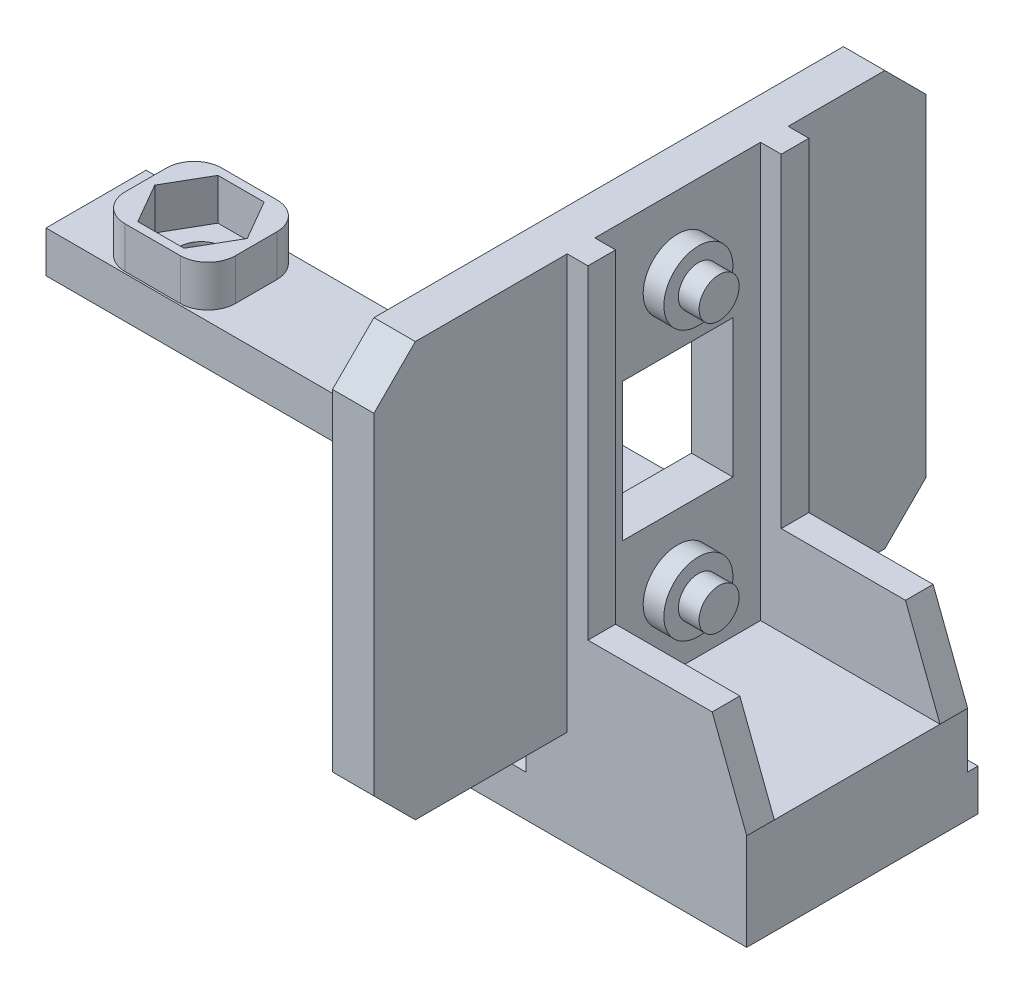
from build123d import *

# Parameters (mm, degrees)
SKETCH1_W               = 56
SKETCH1_H               = 7.25
SKETCH1_R               = 1.6
SKETCH1_W_2             = 5
SKETCH1_H_2             = 16.75
SKETCH1_W_3             = 11.5
BOSS_EXTRUDE1_DEPTH     = 3
SKETCH2_W               = 8
SKETCH2_H               = 7
BOSS_EXTRUDE2_DEPTH     = 3
FILLET1_R               = 2
SKETCH3_W               = 16
SKETCH3_H               = 16
BOSS_EXTRUDE3_DEPTH     = 4
BOSS_EXTRUDE4_DEPTH     = 3
BOSS_EXTRUDE5_DEPTH     = 2
BOSS_EXTRUDE6_DEPTH     = 2
CHAMFER1_SIZE           = 3
SKETCH8_W               = 8
SKETCH8_H               = 10
CUT_EXTRUDE1_DEPTH      = 10
SKETCH9_R               = 1.45
BOSS_EXTRUDE7_DEPTH     = 3
SKETCH11_R              = 2.5
BOSS_EXTRUDE8_DEPTH     = 1.5
CUT_EXTRUDE3_DEPTH      = 74.518705103
CUT_EXTRUDE3_DEPTH_BACK = 2
CUT_EXTRUDE4_DEPTH      = 72.979163652
CUT_EXTRUDE4_DEPTH_BACK = 2


with BuildPart() as part:
    # Sketch1 → Boss-Extrude1 (new body)
    # profile 1 of 4: a face of its own
    with BuildSketch(Plane(origin=(0, 0, 0), x_dir=(1, 0, 0), z_dir=(0, 1, 0))):
        with Locations((-28, 3.625)):
            Rectangle(SKETCH1_W, SKETCH1_H)
        with Locations(Location((-7.6, 3.625, 0), (0, 0, 270))):
            Circle(SKETCH1_R, mode=Mode.SUBTRACT)
        with Locations(Location((-48.4, 3.625, 0), (0, 0, 270))):
            Circle(SKETCH1_R, mode=Mode.SUBTRACT)
    # profile 2 of 4: a face of its own
    with BuildSketch(Plane(origin=(0, 0, 0), x_dir=(1, 0, 0), z_dir=(0, 1, 0))):
        with Locations((-2.5, -8.375)):
            Rectangle(SKETCH1_W_2, SKETCH1_H_2)
    # profile 3 of 4: a face of its own
    with BuildSketch(Plane(origin=(0, 0, 0), x_dir=(1, 0, 0), z_dir=(0, 1, 0))):
        with Locations((5.75, -8.375)):
            Rectangle(SKETCH1_W_3, SKETCH1_H_2)
    # profile 4 of 4: a face of its own
    with BuildSketch(Plane(origin=(0, 0, 0), x_dir=(1, 0, 0), z_dir=(0, 1, 0))):
        with Locations((-10.75, -8.375)):
            Rectangle(SKETCH1_W_3, SKETCH1_H_2)
    extrude(amount=BOSS_EXTRUDE1_DEPTH)

    # Sketch2 → Boss-Extrude2 (add)
    # profile 1 of 2: a face of its own
    with BuildSketch(Plane(origin=(0, 3, 0), x_dir=(1, 0, 0), z_dir=(0, 1, 0))):
        with Locations((-48.4, 3.625)):
            Rectangle(SKETCH2_W, SKETCH2_H)
        Polygon((-46.725684219, 0.725), (-45.051368439, 3.625), (-46.725684219, 6.525), (-50.074315781, 6.525), (-51.748631561, 3.625), (-50.074315781, 0.725), align=None, mode=Mode.SUBTRACT)
    # profile 2 of 2: a face of its own
    with BuildSketch(Plane(origin=(0, 3, 0), x_dir=(1, 0, 0), z_dir=(0, 1, 0))):
        with Locations((-7.6, 3.625)):
            Rectangle(SKETCH2_W, SKETCH2_H)
        Polygon((-5.925684219, 0.725), (-4.251368439, 3.625), (-5.925684219, 6.525), (-9.274315781, 6.525), (-10.948631561, 3.625), (-9.274315781, 0.725), align=None, mode=Mode.SUBTRACT)
    extrude(amount=BOSS_EXTRUDE2_DEPTH)

    # Fillet1
    fillet1_edges = [part.edges().sort_by_distance(p)[0] for p in [
        (-44.4, 4.5, -0.125),
        (-44.4, 4.5, -7.125),
        (-52.4, 4.5, -7.125),
        (-52.4, 4.5, -0.125),
        (-3.6, 4.5, -0.125),
        (-3.6, 4.5, -7.125),
        (-11.6, 4.5, -7.125),
        (-11.6, 4.5, -0.125),
    ]]
    fillet(fillet1_edges, radius=FILLET1_R)

    # Sketch3 → Boss-Extrude3 (add)
    with BuildSketch(Plane(origin=(0, 3, 0), x_dir=(1, 0, 0), z_dir=(0, 1, 0))):
        with Locations((3.5, -8.75)):
            Rectangle(SKETCH3_W, SKETCH3_H)
    extrude(amount=BOSS_EXTRUDE3_DEPTH)

    # Sketch5 → Boss-Extrude4 (add)
    with BuildSketch(Plane.ZY.offset(4.5)):
        Polygon((-9.25, 7), (0.75, 7), (16.75, 7), (30.75, 7), (30.75, 37), (-9.25, 37), align=None)
    extrude(amount=-BOSS_EXTRUDE4_DEPTH)

    # Sketch6 → Boss-Extrude5 (add)
    with BuildSketch(Plane.XY.offset(16.75)):
        Polygon((-1.5, 37), (0, 37), (11.5, 7), (-1.5, 7), align=None)
    extrude(amount=-BOSS_EXTRUDE5_DEPTH)

    # Sketch7 → Boss-Extrude6 (add)
    with BuildSketch(Plane(origin=(0, 0, 0.75), x_dir=(-1, 0, 0), z_dir=(0, 0, -1))):
        Polygon((1.5, 37), (0, 37), (-11.5, 7), (1.5, 7), align=None)
    extrude(amount=-BOSS_EXTRUDE6_DEPTH)

    # Chamfer1
    chamfer1_edges = [part.edges().sort_by_distance(p)[0] for p in [
        (-3, 7, -9.25),
        (-3, 37, -9.25),
        (-3, 37, 30.75),
        (-3, 7, 30.75),
    ]]
    chamfer(chamfer1_edges, length=CHAMFER1_SIZE)

    # Sketch8 → Cut-Extrude1 (cut)
    with BuildSketch(Plane(origin=(-1.5, 0, 0), x_dir=(0, 0, -1), z_dir=(1, 0, 0))):
        with Locations((-8.75, 22)):
            Rectangle(SKETCH8_W, SKETCH8_H)
    extrude(amount=-CUT_EXTRUDE1_DEPTH, mode=Mode.SUBTRACT)

    # Sketch9 → Boss-Extrude7 (add)
    with BuildSketch(Plane(origin=(-1.5, 0, 0), x_dir=(0, 0, -1), z_dir=(1, 0, 0))):
        with Locations(Location((-8.75, 31.75, 0), (0, 0, 180))):
            Circle(SKETCH9_R)
        with Locations(Location((-8.75, 12.25, 0), (0, 0, 180))):
            Circle(SKETCH9_R)
    extrude(amount=BOSS_EXTRUDE7_DEPTH)

    # Sketch11 → Boss-Extrude8 (add)
    with BuildSketch(Plane(origin=(-1.5, 0, 0), x_dir=(0, 0, -1), z_dir=(1, 0, 0))):
        with Locations(Location((-8.75, 31.75, 0), (0, 0, 180))):
            Circle(SKETCH11_R)
        with Locations(Location((-8.75, 12.25, 0), (0, 0, 180))):
            Circle(SKETCH11_R)
    extrude(amount=BOSS_EXTRUDE8_DEPTH)

    # Sketch13 → Cut-Extrude3 (cut, two sides: drawn at the far end of the back side and taken through both)
    with BuildSketch(Plane(origin=(0, 0, 0.75), x_dir=(-1, 0, 0), z_dir=(0, 0, -1)).offset(-CUT_EXTRUDE3_DEPTH_BACK)):
        Polygon((0, 185.220530074), (0, 37), (0, 13.52173913), (-9, 13.52173913), (-157.220530074, 13.52173913), (-375.851096448, 213.716588185), (-218.630566375, 385.415379128), align=None)
    extrude(amount=CUT_EXTRUDE3_DEPTH + CUT_EXTRUDE3_DEPTH_BACK, mode=Mode.SUBTRACT)

    # Sketch14 → Cut-Extrude4 (cut, two sides: drawn at the far end of the back side and taken through both)
    with BuildSketch(Plane.XY.offset(16.75).offset(-CUT_EXTRUDE4_DEPTH_BACK)):
        Polygon((0, 185.220530074), (0, 37), (0, 13.52173913), (9, 13.52173913), (157.220530074, 13.52173913), (375.851096448, 213.716588185), (218.630566375, 385.415379128), align=None)
    extrude(amount=CUT_EXTRUDE4_DEPTH + CUT_EXTRUDE4_DEPTH_BACK, mode=Mode.SUBTRACT)


solid = part.part
